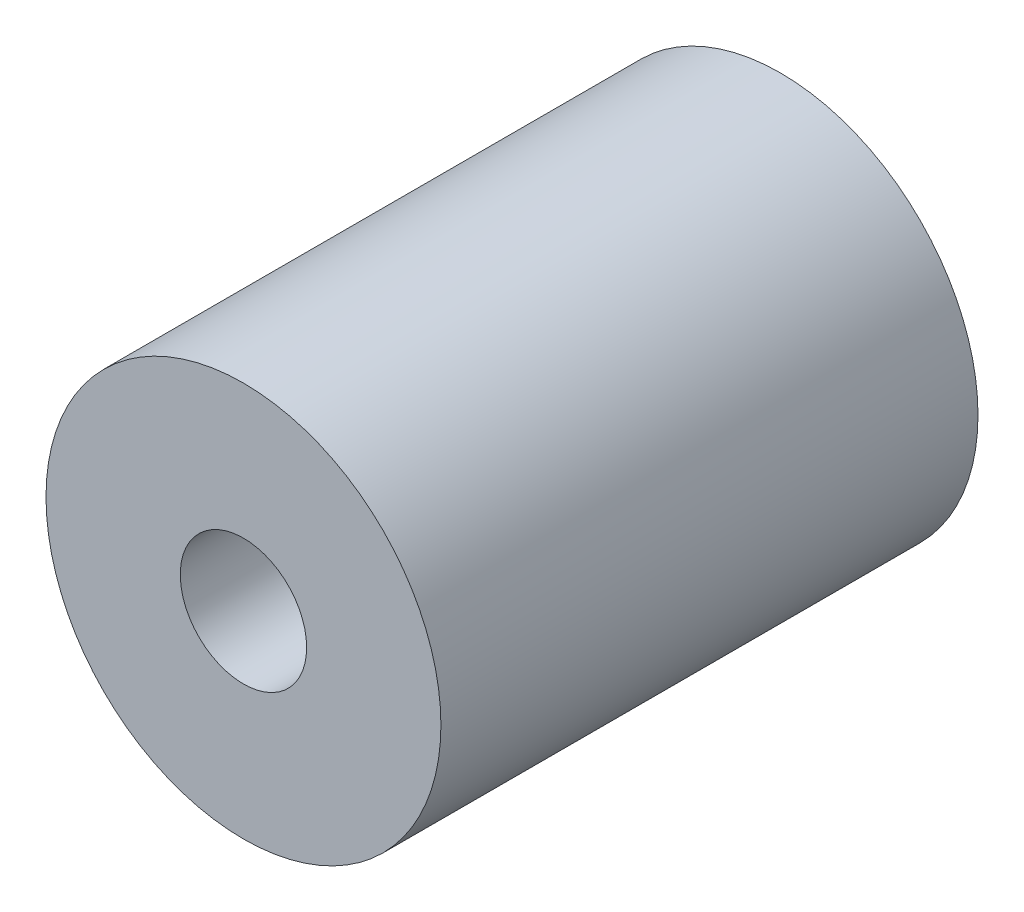
from build123d import *

# Parameters (mm, degrees)
SKIZZE1_R                       = 12.5
AUFSATZ_LINEAR_AUSTRAGEN1_DEPTH = 34
SKIZZE2_R                       = 4
SCHNITT_LINEAR_AUSTRAGEN1_DEPTH = 12
SKIZZE3_R                       = 5
SCHNITT_LINEAR_AUSTRAGEN2_DEPTH = 12


with BuildPart() as part:
    # Skizze1 → Aufsatz-Linear austragen1 (new body)
    with BuildSketch(Plane.XY):
        Circle(SKIZZE1_R)
    extrude(amount=AUFSATZ_LINEAR_AUSTRAGEN1_DEPTH)

    # Skizze2 → Schnitt-Linear austragen1 (cut)
    with BuildSketch(Plane.XY.offset(34)):
        Circle(SKIZZE2_R)
    extrude(amount=-SCHNITT_LINEAR_AUSTRAGEN1_DEPTH, mode=Mode.SUBTRACT)

    # Skizze3 → Schnitt-Linear austragen2 (cut)
    with BuildSketch(Plane(origin=(0, 0, 0), x_dir=(-1, 0, 0), z_dir=(0, 0, -1))):
        Circle(SKIZZE3_R)
    extrude(amount=-SCHNITT_LINEAR_AUSTRAGEN2_DEPTH, mode=Mode.SUBTRACT)


solid = part.part
